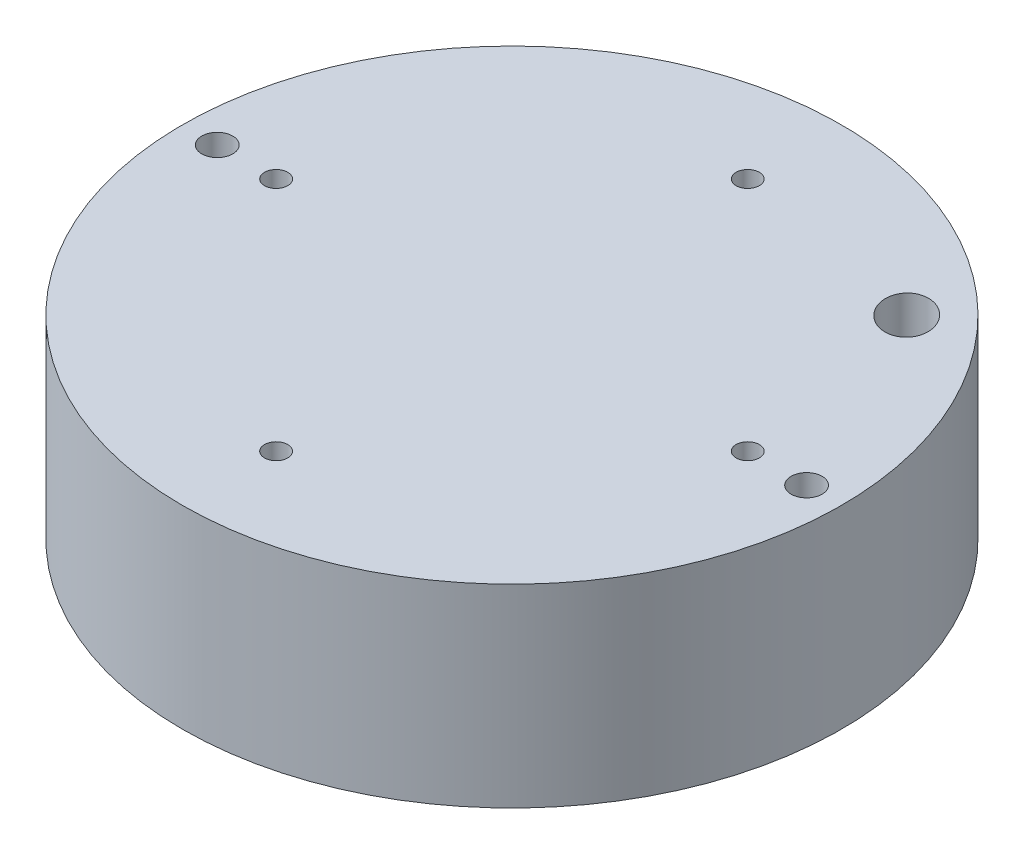
from build123d import *

# Parameters (mm, degrees)
CROQUIS1_R              = 42.5
SALIENTE_EXTRUIR1_DEPTH = 25
CROQUIS2_R              = 1.5
CROQUIS2_R_2            = 2
CROQUIS2_RX             = 3.5
CROQUIS2_RY             = 3
CORTAR_EXTRUIR1_DEPTH   = 25


with BuildPart() as part:
    # Croquis1 → Saliente-Extruir1 (new body)
    with BuildSketch(Plane(origin=(0, 0, 0), x_dir=(1, 0, 0), z_dir=(0, 1, 0))):
        with Locations(Location((0, 0, 0), (0, 0, 270))):
            Circle(CROQUIS1_R)
    extrude(amount=SALIENTE_EXTRUIR1_DEPTH)

    # Croquis2 → Cortar-Extruir1 (cut)
    with BuildSketch(Plane(origin=(0, 25, 0), x_dir=(1, 0, 0), z_dir=(0, 1, 0))):
        with Locations(Location((0, 30.405, 0), (0, 0, 270))):
            Circle(CROQUIS2_R)
        with Locations(Location((30.405, 0, 0), (0, 0, 270))):
            Circle(CROQUIS2_R)
        with Locations(Location((0, -30.405, 0), (0, 0, 270))):
            Circle(CROQUIS2_R)
        with Locations(Location((-30.405, 0, 0), (0, 0, 270))):
            Circle(CROQUIS2_R)
        with Locations(Location((-38, 0, 0), (0, 0, 270))):
            Circle(CROQUIS2_R_2)
        with Locations(Location((38, 0, 0), (0, 0, 270))):
            Circle(CROQUIS2_R_2)
        with Locations(Location((25.455844123, 25.455844123), (0, 0, -48.360743663))):
            Ellipse(CROQUIS2_RX, CROQUIS2_RY)
    extrude(amount=-CORTAR_EXTRUIR1_DEPTH, mode=Mode.SUBTRACT)


solid = part.part
